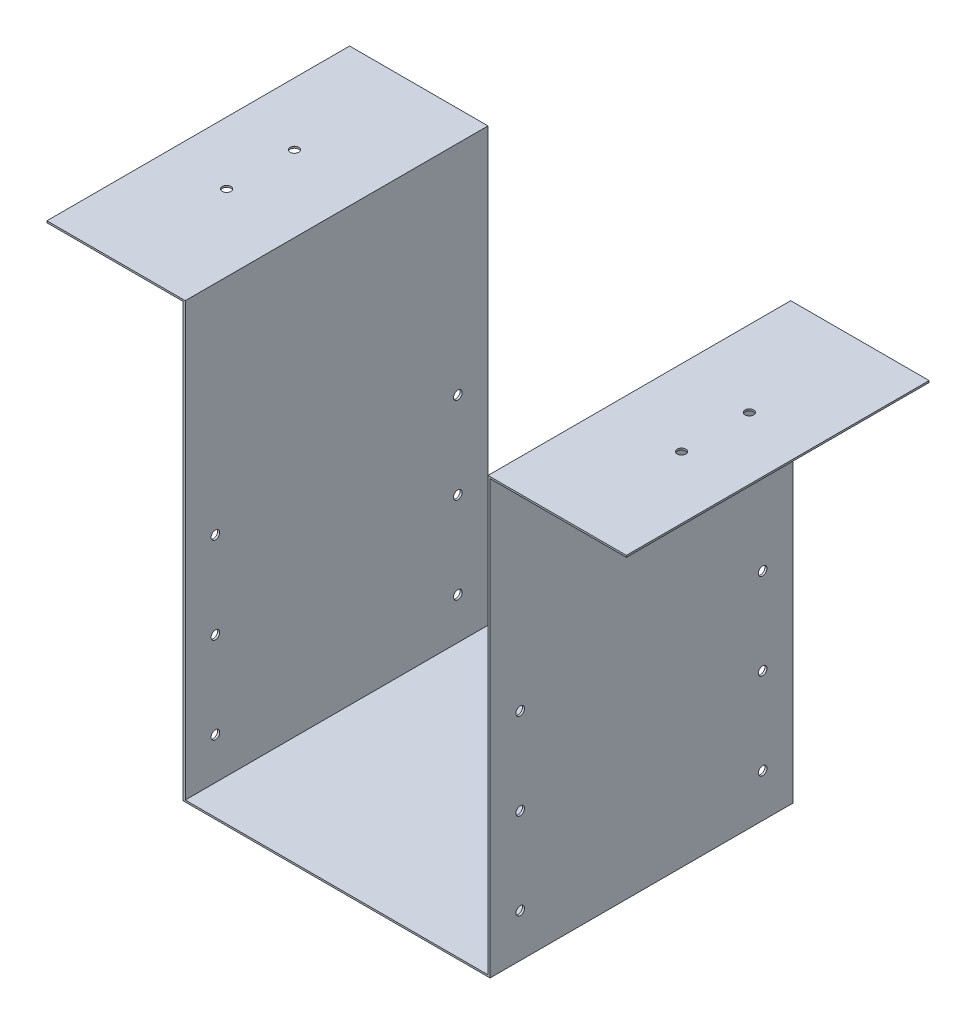
from build123d import *

# Parameters (mm, degrees)
SKETCH1_W           = 175
SKETCH1_H           = 175
BOSS_EXTRUDE1_DEPTH = 1
SKETCH2_W           = 1.2
SKETCH2_H           = 175
BOSS_EXTRUDE2_DEPTH = 250
SKETCH3_W           = 80
SKETCH3_H           = 175
BOSS_EXTRUDE3_DEPTH = 1
SKETCH4_R           = 2.5
CUT_EXTRUDE1_DEPTH  = 10
SKETCH6_R           = 2.5
CUT_EXTRUDE2_DEPTH  = 300


with BuildPart() as part:
    # Sketch1 → Boss-Extrude1 (new body)
    with BuildSketch(Plane(origin=(0, 0, 0), x_dir=(1, 0, 0), z_dir=(0, 1, 0))):
        Rectangle(SKETCH1_W, SKETCH1_H)
    extrude(amount=BOSS_EXTRUDE1_DEPTH)

    # Sketch2 → Boss-Extrude2 (add)
    with BuildSketch(Plane.XZ):
        with Locations((-88.1, 0)):
            Rectangle(SKETCH2_W, SKETCH2_H)
        with Locations((88.1, 0)):
            Rectangle(SKETCH2_W, SKETCH2_H)
    extrude(amount=-BOSS_EXTRUDE2_DEPTH)

    # Sketch3 → Boss-Extrude3 (add)
    with BuildSketch(Plane(origin=(0, 250, 0), x_dir=(1, 0, 0), z_dir=(0, 1, 0))):
        with Locations((-127.5, 0)):
            Rectangle(SKETCH3_W, SKETCH3_H)
        with Locations((127.5, 0)):
            Rectangle(SKETCH3_W, SKETCH3_H)
    extrude(amount=BOSS_EXTRUDE3_DEPTH)

    # Sketch4 → Cut-Extrude1 (cut)
    with BuildSketch(Plane(origin=(0, 251, 0), x_dir=(1, 0, 0), z_dir=(0, 1, 0))):
        with Locations(Location((131.5, 19.6, 0), (0, 0, 270))):
            Circle(SKETCH4_R)
        with Locations(Location((131.5, -19.6, 0), (0, 0, 90))):
            Circle(SKETCH4_R)
        with Locations(Location((-131.5, -19.6, 0), (0, 0, 270))):
            Circle(SKETCH4_R)
        with Locations(Location((-131.5, 19.6, 0), (0, 0, 90))):
            Circle(SKETCH4_R)
    extrude(amount=-CUT_EXTRUDE1_DEPTH, mode=Mode.SUBTRACT)

    # Sketch6 → Cut-Extrude2 (cut)
    with BuildSketch(Plane(origin=(88.7, 0, 0), x_dir=(0, 0, -1), z_dir=(1, 0, 0))):
        with Locations((70.077336333, 25)):
            Circle(SKETCH6_R)
        with Locations((70.077336333, 75)):
            Circle(SKETCH6_R)
        with Locations((70.077336333, 125)):
            Circle(SKETCH6_R)
        with Locations(Location((-70.077336333, 125, 0), (0, 0, 180))):
            Circle(SKETCH6_R)
        with Locations(Location((-70.077336333, 75, 0), (0, 0, 180))):
            Circle(SKETCH6_R)
        with Locations(Location((-70.077336333, 25, 0), (0, 0, 180))):
            Circle(SKETCH6_R)
    extrude(amount=-CUT_EXTRUDE2_DEPTH, mode=Mode.SUBTRACT)


solid = part.part
